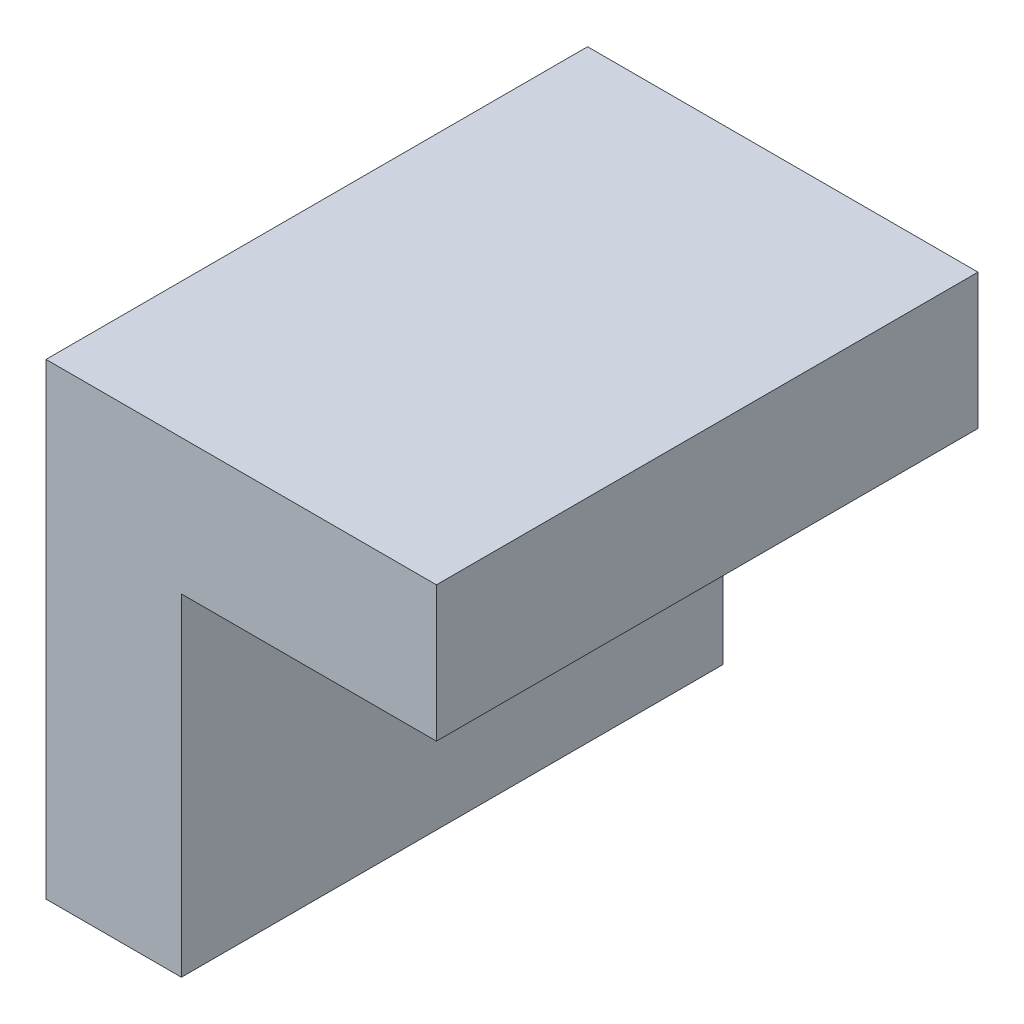
from build123d import *

# Parameters (mm, degrees)
EXTRUDE_THIN1_DEPTH = 80


with BuildPart() as part:
    # Sketch1 → Extrude-Thin1 (new body)
    with BuildSketch(Plane.XY):
        Polygon((10, 0), (10, 49.044906765), (47.674772692, 49.044906765), (47.674772692, 69.044906765), (-10, 69.044906765), (-10, 0), align=None)
    extrude(amount=EXTRUDE_THIN1_DEPTH)


solid = part.part
